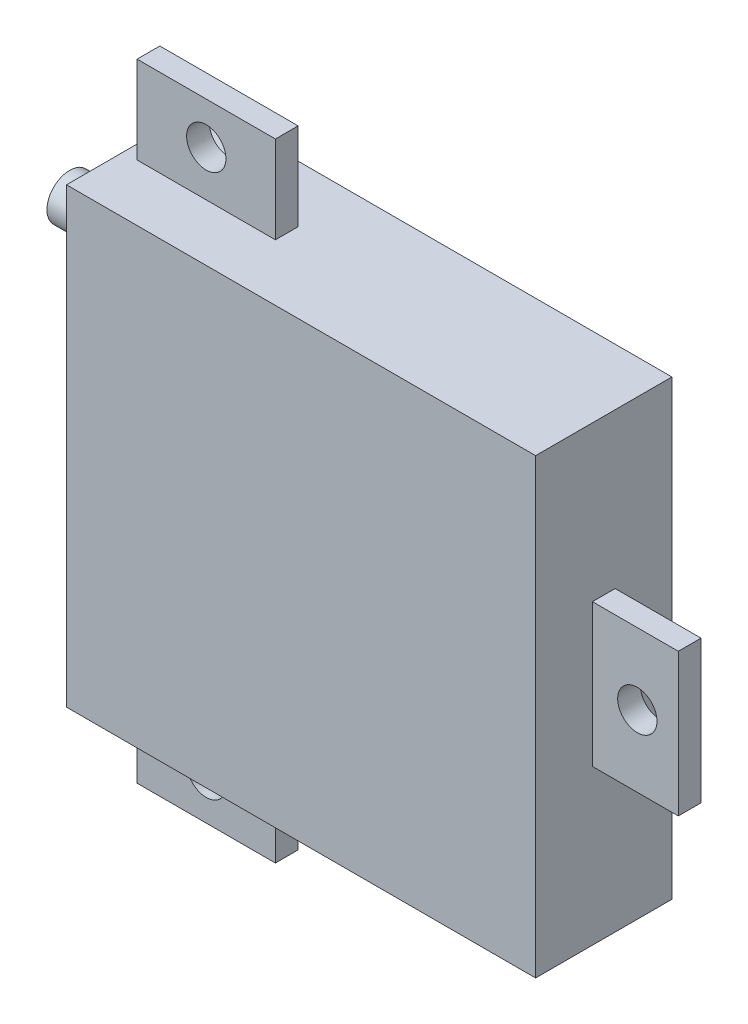
from build123d import *

# Parameters (mm, degrees)
SKETCH1_W           = 32.7406
SKETCH1_H           = 31.5722
BOSS_EXTRUDE1_DEPTH = 3.9624
SKETCH2_R           = 1.3716
BOSS_EXTRUDE2_DEPTH = 1.5875
SKETCH3_W           = 32.7406
SKETCH3_H           = 31.5722
BOSS_EXTRUDE3_DEPTH = 3.9624
SKETCH4_R           = 1.5875
BOSS_EXTRUDE4_DEPTH = 4.7625


with BuildPart() as part:
    # Sketch1 → Boss-Extrude1 (new body)
    with BuildSketch(Plane.XY):
        with Locations((116.543894781, 33.611845874)):
            Rectangle(SKETCH1_W, SKETCH1_H)
    extrude(amount=BOSS_EXTRUDE1_DEPTH)

    # Sketch2 → Boss-Extrude2 (add)
    with BuildSketch(Plane.XY.offset(3.9624)):
        Polygon((100.173594781, 49.397945874), (101.138794781, 49.397945874), (101.138794781, 55.493945874), (110.790794781, 55.493945874), (110.790794781, 49.397945874), (132.914194781, 49.397945874), (132.914194781, 38.590245874), (138.908594781, 38.590245874), (138.908594781, 28.633445874), (132.914194781, 28.633445874), (132.914194781, 17.825745874), (110.790794781, 17.825745874), (110.790794781, 11.729745874), (101.138794781, 11.729745874), (101.138794781, 17.825745874), (100.173594781, 17.825745874), align=None)
        with Locations((136.050967198, 33.611845874)):
            Circle(SKETCH2_R, mode=Mode.SUBTRACT)
        with Locations((105.964794781, 52.572945874)):
            Circle(SKETCH2_R, mode=Mode.SUBTRACT)
        with Locations((105.964794781, 14.650745874)):
            Circle(SKETCH2_R, mode=Mode.SUBTRACT)
    extrude(amount=BOSS_EXTRUDE2_DEPTH)

    # Sketch3 → Boss-Extrude3 (add)
    with BuildSketch(Plane.XY.offset(5.5499)):
        with Locations((116.543894781, 33.611845874)):
            Rectangle(SKETCH3_W, SKETCH3_H)
    extrude(amount=BOSS_EXTRUDE3_DEPTH)

    # Sketch4 → Boss-Extrude4 (add)
    with BuildSketch(Plane.ZY.offset(-100.173594781)):
        with Locations(Location((4.52755, 43.809945874, 0), (0, 0, 180))):
            Circle(SKETCH4_R)
    extrude(amount=BOSS_EXTRUDE4_DEPTH)


solid = part.part
